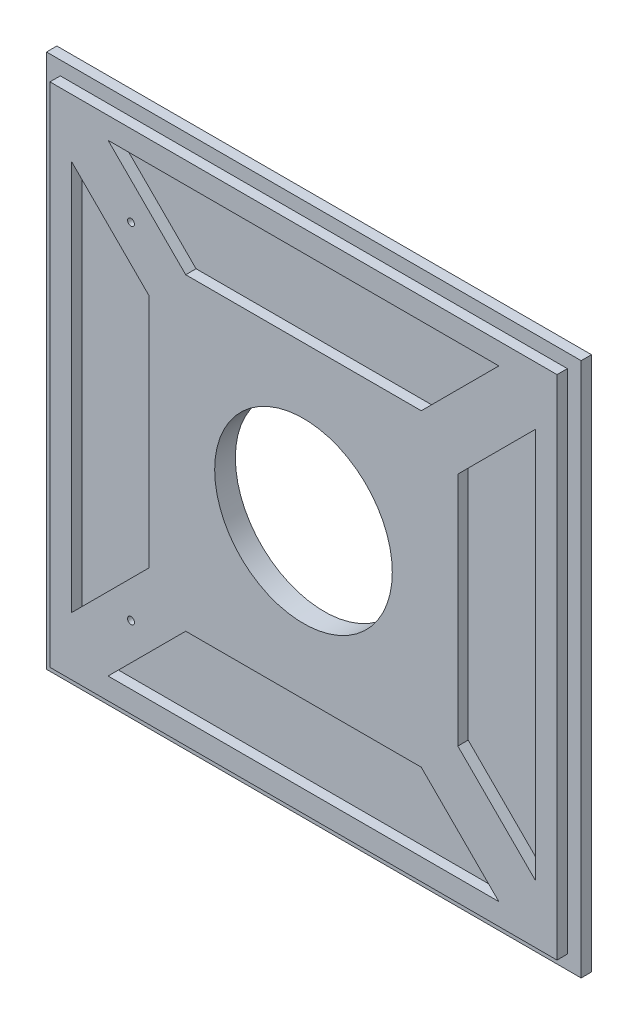
from build123d import *

# Parameters (mm, degrees)
SKETCH1_W           = 310
SKETCH1_H           = 310
BOSS_EXTRUDE1_DEPTH = 6
BOSS_EXTRUDE2_DEPTH = 6
SKETCH4_R           = 51.5
CUT_EXTRUDE1_DEPTH  = 439.570404838
SKETCH11_R          = 2
CUT_EXTRUDE5_DEPTH  = 439.570404838
SKETCH12_W          = 25
SKETCH12_H          = 10
BOSS_EXTRUDE3_DEPTH = 6.5
SKETCH13_W          = 25
SKETCH13_H          = 112
BOSS_EXTRUDE4_DEPTH = 8


with BuildPart() as part:
    # Sketch1 → Boss-Extrude1 (new body)
    with BuildSketch(Plane.XY):
        with Locations((155, -155)):
            Rectangle(SKETCH1_W, SKETCH1_H)
    extrude(amount=BOSS_EXTRUDE1_DEPTH)

    # Sketch3 → Boss-Extrude2 (add)
    with BuildSketch(Plane.XY.offset(6)):
        Polygon((302, -8), (302, -33), (302, -277), (302, -302), (277, -302), (33, -302), (8, -302), (8, -277), (8, -33), (8, -8), (33, -8), (277, -8), align=None)
        Polygon((268.286796564, -20.5), (223.286796564, -65.5), (86.713203436, -65.5), (41.713203436, -20.5), align=None, mode=Mode.SUBTRACT)
        Polygon((20.5, -41.713203436), (65.5, -86.713203436), (65.5, -223.286796564), (20.5, -268.286796564), align=None, mode=Mode.SUBTRACT)
        Polygon((41.713203436, -289.5), (86.713203436, -244.5), (223.286796564, -244.5), (268.286796564, -289.5), align=None, mode=Mode.SUBTRACT)
        Polygon((289.5, -41.713203436), (244.5, -86.713203436), (244.5, -223.286796564), (289.5, -268.286796564), align=None, mode=Mode.SUBTRACT)
    extrude(amount=BOSS_EXTRUDE2_DEPTH)

    # Sketch4 → Cut-Extrude1 (cut, through all)
    with BuildSketch(Plane.XY.offset(12)):
        with Locations((155, -155)):
            Circle(SKETCH4_R)
    extrude(amount=-CUT_EXTRUDE1_DEPTH, mode=Mode.SUBTRACT)

    # Sketch11 → Cut-Extrude5 (cut, through all)
    with BuildSketch(Plane(origin=(0, 0, 0), x_dir=(-1, 0, 0), z_dir=(0, 0, -1))):
        with Locations((-55, -55)):
            Circle(SKETCH11_R)
        with Locations((-55, -255)):
            Circle(SKETCH11_R)
    extrude(amount=-CUT_EXTRUDE5_DEPTH, mode=Mode.SUBTRACT)

    # Sketch12 → Boss-Extrude3 (add)
    with BuildSketch(Plane(origin=(0, 0, 0), x_dir=(-1, 0, 0), z_dir=(0, 0, -1))):
        with Locations((-272.5, -104)):
            Rectangle(SKETCH12_W, SKETCH12_H)
        with Locations((-272.5, -206)):
            Rectangle(SKETCH12_W, SKETCH12_H)
    extrude(amount=BOSS_EXTRUDE3_DEPTH)

    # Sketch13 → Boss-Extrude4 (add)
    with BuildSketch(Plane(origin=(0, 0, -6.5), x_dir=(-1, 0, 0), z_dir=(0, 0, -1))):
        with Locations((-272.5, -155)):
            Rectangle(SKETCH13_W, SKETCH13_H)
    extrude(amount=BOSS_EXTRUDE4_DEPTH)


solid = part.part
